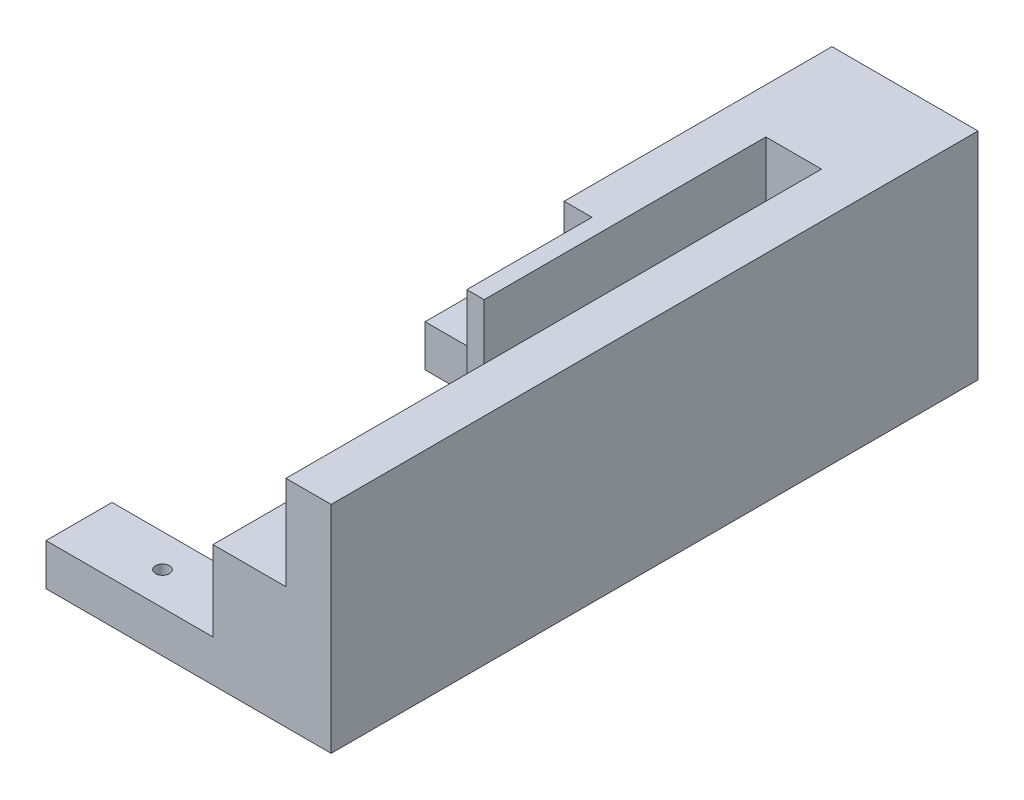
from build123d import *

# Parameters (mm, degrees)
CROQUIS1_R               = 0.5
SALIENTE_EXTRUIR1_DEPTH  = 3
SALIENTE_EXTRUIR2_DEPTH  = 11
SALIENTE_EXTRUIR3_DEPTH  = 5.75
CROQUIS4_R               = 2
CROQUIS4_R_2             = 1
CORTAR_EXTRUIR1_DEPTH    = 4
SALIENTE_EXTRUIR5_START  = 4
CROQUIS6_R               = 2
CROQUIS6_R_2             = 1
SALIENTE_EXTRUIR5_DEPTH  = 4
SALIENTE_EXTRUIR6_DEPTH  = 1.5
CROQUIS9_W               = 44.5
CROQUIS9_H               = 15.5
SALIENTE_EXTRUIR7_DEPTH  = 1
CROQUIS11_W              = 10.5
CROQUIS11_H              = 15.5
SALIENTE_EXTRUIR10_DEPTH = 2
CROQUIS7_R               = 2.25
CORTAR_EXTRUIR2_DEPTH    = 2


with BuildPart() as part:
    # Croquis1 → Saliente-Extruir1 (new body)
    with BuildSketch(Plane(origin=(0, 0, 0), x_dir=(1, 0, 0), z_dir=(0, 1, 0))):
        Polygon((-6, -0.75), (-6, -5.5), (4, -5.5), (13.5, -5.5), (13.5, 26.5), (13.5, 39), (4, 39), (4, 26.5), (-6, 26.5), (-6, 21.75), (4, 21.75), (6, 21.75), (6, 11.25), (6, -0.75), align=None)
        with Locations(Location((0, -3.125, 0), (0, 0, 270))):
            Circle(CROQUIS1_R, mode=Mode.SUBTRACT)
        with Locations(Location((0, 24.125, 0), (0, 0, 270))):
            Circle(CROQUIS1_R, mode=Mode.SUBTRACT)
    extrude(amount=SALIENTE_EXTRUIR1_DEPTH)

    # Croquis2 → Saliente-Extruir2 (add)
    with BuildSketch(Plane(origin=(0, 3, 0), x_dir=(1, 0, 0), z_dir=(0, 1, 0))):
        Polygon((11.25, -5.5), (13.5, -5.5), (13.5, 26.5), (13.5, 39), (4, 39), (4, 26.5), (4, 21.75), (6, 21.75), (6, 12.75), (7.25, 12.75), (7.25, 33), (11.25, 33), align=None)
    extrude(amount=SALIENTE_EXTRUIR2_DEPTH)

    # Croquis3 → Saliente-Extruir3 (add)
    with BuildSketch(Plane(origin=(0, 3, 0), x_dir=(1, 0, 0), z_dir=(0, 1, 0))):
        Polygon((11.25, -5.5), (11.25, 33), (7.25, 33), (7.25, 12.75), (6, 12.75), (6, -5.5), align=None)
    extrude(amount=SALIENTE_EXTRUIR3_DEPTH)

    # Croquis4 → Cortar-Extruir1 (cut)
    with BuildSketch(Plane(origin=(0, 0, -39), x_dir=(-1, 0, 0), z_dir=(0, 0, -1))):
        with Locations((-9.87, 11.055)):
            Circle(CROQUIS4_R)
        with Locations((-9.87, 5.555)):
            Circle(CROQUIS4_R_2)
        with Locations((-9.87, 2.055)):
            Circle(CROQUIS4_R_2)
    extrude(amount=-CORTAR_EXTRUIR1_DEPTH, mode=Mode.SUBTRACT)

    # Croquis6 → Saliente-Extruir5 (add)
    with BuildSketch(Plane(origin=(0, 0, -35), x_dir=(-1, 0, 0), z_dir=(0, 0, -1)).offset(SALIENTE_EXTRUIR5_START)):
        with Locations((-9.87, 11.055)):
            Circle(CROQUIS6_R)
        with Locations((-9.87, 5.555)):
            Circle(CROQUIS6_R_2)
        with Locations((-9.87, 2.055)):
            Circle(CROQUIS6_R_2)
    extrude(amount=-SALIENTE_EXTRUIR5_DEPTH)

    # Croquis8 → Saliente-Extruir6 (add)
    with BuildSketch(Plane(origin=(0, 14, 0), x_dir=(1, 0, 0), z_dir=(0, 1, 0))):
        Polygon((4, 39), (4, 21.75), (6, 21.75), (6, 12.75), (7.25, 12.75), (7.25, 33), (11.25, 33), (11.25, -5.5), (13.5, -5.5), (13.5, 39), align=None)
    extrude(amount=SALIENTE_EXTRUIR6_DEPTH)

    # Croquis9 → Saliente-Extruir7 (add)
    with BuildSketch(Plane(origin=(13.5, 0, 0), x_dir=(0, 0, -1), z_dir=(1, 0, 0))):
        with Locations((16.75, 7.75)):
            Rectangle(CROQUIS9_W, CROQUIS9_H)
    extrude(amount=SALIENTE_EXTRUIR7_DEPTH)

    # Croquis11 → Saliente-Extruir10 (add)
    with BuildSketch(Plane(origin=(0, 0, -39), x_dir=(-1, 0, 0), z_dir=(0, 0, -1))):
        with Locations((-9.25, 7.75)):
            Rectangle(CROQUIS11_W, CROQUIS11_H)
    extrude(amount=SALIENTE_EXTRUIR10_DEPTH)

    # Croquis7 → Cortar-Extruir2 (cut)
    with BuildSketch(Plane(origin=(0, 0, -41), x_dir=(-1, 0, 0), z_dir=(0, 0, -1))):
        with Locations((-9.87, 11.055)):
            Circle(CROQUIS7_R)
    extrude(amount=-CORTAR_EXTRUIR2_DEPTH, mode=Mode.SUBTRACT)


solid = part.part
